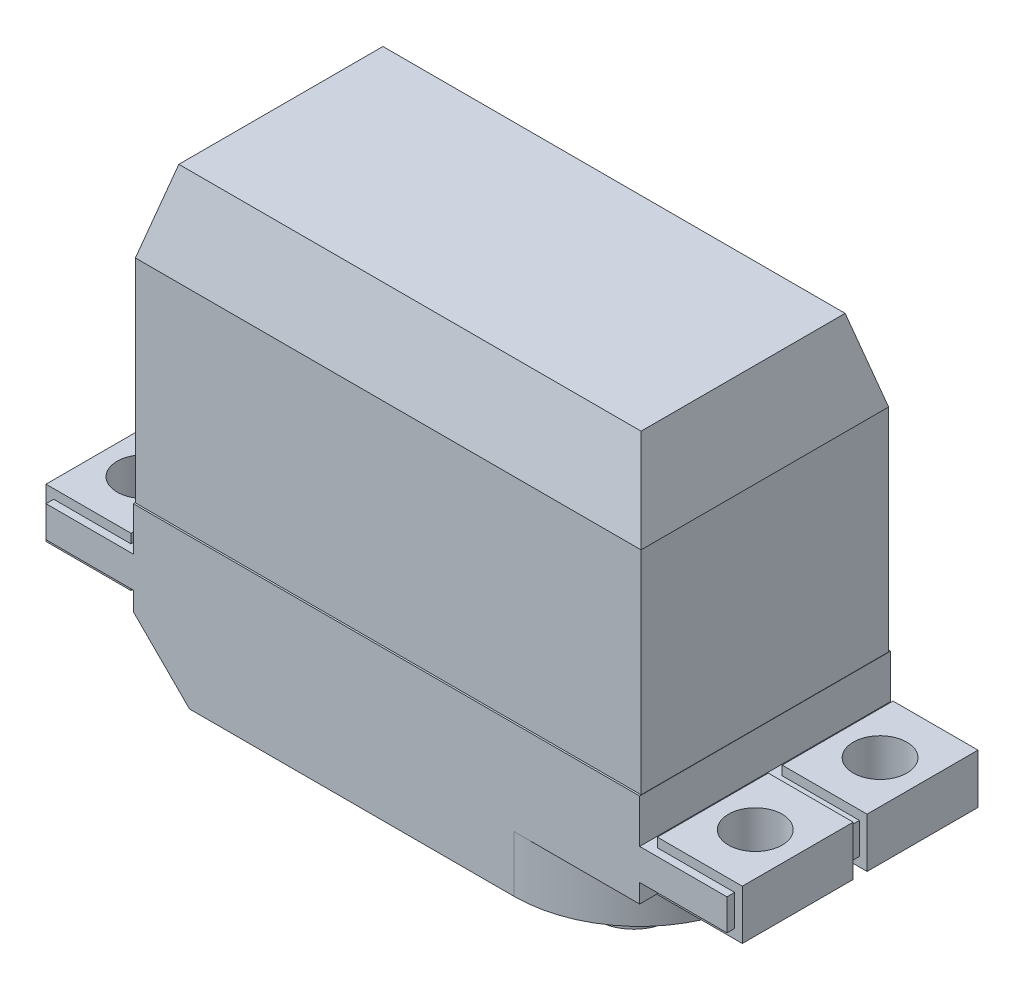
from build123d import *
from build123d.topology import SkipClean

# Parameters (mm, degrees)
SCHIZZO1_W                   = 40.53
SCHIZZO1_H                   = 19.84
ESTRUSIONE_ESTRUSIONE1_DEPTH = 17
SCHIZZO2_W                   = 40.53
SCHIZZO2_H                   = 19.84
ESTRUSIONE_ESTRUSIONE2_DEPTH = 6.5
ESTRUSIONE_ESTRUSIONE2_TAPER = 15
SCHIZZO3_W                   = 40.58
SCHIZZO3_H                   = 20.12
ESTRUSIONE_ESTRUSIONE3_DEPTH = 7.5
SCHIZZO5_W                   = 30.52
SCHIZZO5_H                   = 20.12
ESTRUSIONE_ESTRUSIONE4_DEPTH = 4.5
SCHIZZO6_R                   = 6.035
ESTRUSIONE_ESTRUSIONE5_DEPTH = 1.5
SCHIZZO7_R                   = 2.9
ESTRUSIONE_ESTRUSIONE6_DEPTH = 4
SMUSSO1_SIZE                 = 4.5
ESTRUSIONE_ESTRUSIONE7_DEPTH = 2.5
SCHIZZO11_W                  = 6.81
SCHIZZO11_H                  = 8.89
SCHIZZO11_R                  = 2.15
ESTRUSIONE_ESTRUSIONE8_DEPTH = 1.99


with BuildPart() as part:
    # Schizzo1 → Estrusione-Estrusione1 (new body)
    with BuildSketch(Plane(origin=(0, 0, 0), x_dir=(1, 0, 0), z_dir=(0, 1, 0))):
        Rectangle(SCHIZZO1_W, SCHIZZO1_H)
    extrude(amount=ESTRUSIONE_ESTRUSIONE1_DEPTH)

    # Schizzo2 → Estrusione-Estrusione2 (add)
    with BuildSketch(Plane(origin=(0, 17, 0), x_dir=(1, 0, 0), z_dir=(0, 1, 0))):
        Rectangle(SCHIZZO2_W, SCHIZZO2_H)
    extrude(amount=ESTRUSIONE_ESTRUSIONE2_DEPTH, taper=ESTRUSIONE_ESTRUSIONE2_TAPER)

    # Schizzo3 → Estrusione-Estrusione3 (add)
    with BuildSketch(Plane(origin=(0, 0, 0), x_dir=(-1, 0, 0), z_dir=(0, -1, 0))):
        Rectangle(SCHIZZO3_W, SCHIZZO3_H)
    extrude(amount=ESTRUSIONE_ESTRUSIONE3_DEPTH)

    # Schizzo5 → Estrusione-Estrusione4 (add)
    with BuildSketch(Plane.XZ.offset(7.5)):
        with BuildLine():
            Line((10.23, -10.06), (10.23, 10.06))
            ThreePointArc((10.23, 10.06), (20.29, 0), (10.23, -10.06))
        make_face()
        with Locations((-5.03, 0)):
            Rectangle(SCHIZZO5_W, SCHIZZO5_H)
    extrude(amount=ESTRUSIONE_ESTRUSIONE4_DEPTH)

    # Schizzo6 → Estrusione-Estrusione5 (add)
    with BuildSketch(Plane.XZ.offset(12)):
        with Locations(Location((9.755, 0, 0), (0, 0, 270))):
            Circle(SCHIZZO6_R)
    extrude(amount=ESTRUSIONE_ESTRUSIONE5_DEPTH)

    # Schizzo7 → Estrusione-Estrusione6 (add)
    with BuildSketch(Plane.XZ.offset(13.5)):
        with Locations(Location((9.755, 0, 0), (0, 0, 270))):
            Circle(SCHIZZO7_R)
    extrude(amount=ESTRUSIONE_ESTRUSIONE6_DEPTH)

    # Smusso1
    smusso1_edges = [part.edges().sort_by_distance(p)[0] for p in [
        (-20.29, -12, 0),
    ]]
    chamfer(smusso1_edges, length=SMUSSO1_SIZE)

    # Schizzo8 → Estrusione-Estrusione7 (add)
    with BuildSketch(Plane(origin=(0, -3.5, 0), x_dir=(1, 0, 0), z_dir=(0, 1, 0))):
        with BuildLine():
            Line((-27.29, -10.06), (-20.29, -10.06))
            Line((-20.29, -10.06), (-20.29, 10.06))
            Line((-20.29, 10.06), (-27.29, 10.06))
            Line((-27.29, 10.06), (-27.29, 6.2))
            Line((-27.29, 6.2), (-26.283956277, 6.2))
            ThreePointArc((-26.283956277, 6.2), (-23.872706606, 7.056453986), (-22.35, 5))
            ThreePointArc((-22.35, 5), (-23.872706606, 2.943546014), (-26.283956277, 3.8))
            Line((-26.283956277, 3.8), (-27.29, 3.8))
            Line((-27.29, 3.8), (-27.29, -3.8))
            Line((-27.29, -3.8), (-26.283956277, -3.8))
            ThreePointArc((-26.283956277, -3.8), (-23.872706606, -2.943546014), (-22.35, -5))
            ThreePointArc((-22.35, -5), (-23.872706606, -7.056453986), (-26.283956277, -6.2))
            Line((-26.283956277, -6.2), (-27.29, -6.2))
            Line((-27.29, -6.2), (-27.29, -10.06))
        make_face()
        with BuildLine():
            Line((20.29, -10.06), (27.29, -10.06))
            Line((27.29, -10.06), (27.29, -6.2))
            Line((27.29, -6.2), (26.283956277, -6.2))
            ThreePointArc((26.283956277, -6.2), (22.35, -5), (26.283956277, -3.8))
            Line((26.283956277, -3.8), (27.29, -3.8))
            Line((27.29, -3.8), (27.29, 3.8))
            Line((27.29, 3.8), (26.283956277, 3.8))
            ThreePointArc((26.283956277, 3.8), (22.35, 5), (26.283956277, 6.2))
            Line((26.283956277, 6.2), (27.29, 6.2))
            Line((27.29, 6.2), (27.29, 10.06))
            Line((27.29, 10.06), (20.29, 10.06))
            Line((20.29, 10.06), (20.29, -10.06))
        make_face()
    extrude(amount=-ESTRUSIONE_ESTRUSIONE7_DEPTH)

    # Schizzo11 → Estrusione-Estrusione8 (add, symmetric)
    # profile 1 of 2: a face of its own
    with BuildSketch(Plane(origin=(0, -4.75, 0), x_dir=(-1, 0, 0), z_dir=(0, -1, 0))):
        with Locations((24.5, 5)):
            Rectangle(SCHIZZO11_W, SCHIZZO11_H)
        with Locations(Location((24.5, 5, 0), (0, 0, 90))):
            Circle(SCHIZZO11_R, mode=Mode.SUBTRACT)
    # profile 2 of 2: a face of its own
    with BuildSketch(Plane(origin=(0, -4.75, 0), x_dir=(-1, 0, 0), z_dir=(0, -1, 0))):
        with Locations((24.5, -5)):
            Rectangle(SCHIZZO11_W, SCHIZZO11_H)
        with Locations(Location((24.5, -5, 0), (0, 0, 90))):
            Circle(SCHIZZO11_R, mode=Mode.SUBTRACT)
    estrusione_estrusione8 = extrude(amount=ESTRUSIONE_ESTRUSIONE8_DEPTH, both=True)

    # Specchia1: Estrusione-Estrusione8 across plane
    with SkipClean():  # the faces are left unmerged after this step: merging them gives an invalid solid
        add(estrusione_estrusione8.mirror(Plane(origin=(0, 0, 0), x_dir=(0, 0, 1), z_dir=(1, 0, 0))))


solid = part.part
